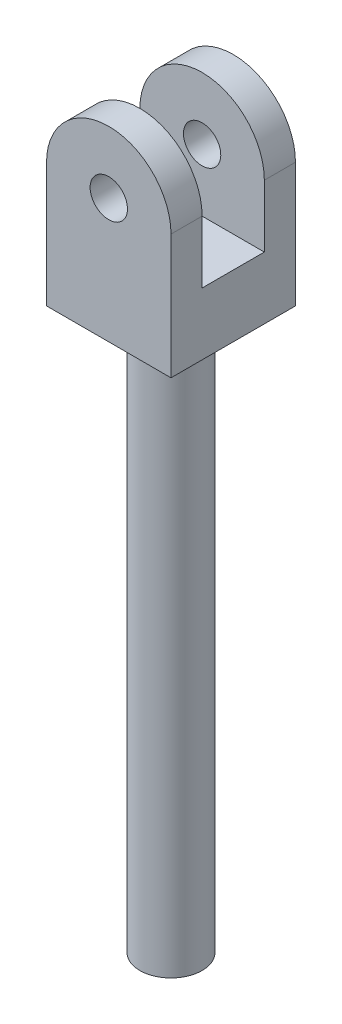
from build123d import *

# Parameters (mm, degrees)
CROQUIS1_R              = 1.5
SALIENTE_EXTRUIR1_DEPTH = 10
CROQUIS2_R              = 2.5
SALIENTE_EXTRUIR2_DEPTH = 45
CROQUIS3_W              = 5
CROQUIS3_H              = 10
CORTAR_EXTRUIR1_DEPTH   = 40


with BuildPart() as part:
    # Croquis1 → Saliente-Extruir1 (new body)
    with BuildSketch(Plane.XY):
        with BuildLine():
            Line((-5, 0), (-5, -10))
            Line((-5, -10), (5, -10))
            Line((5, -10), (5, 0))
            ThreePointArc((5, 0), (0, 5), (-5, 0))
        make_face()
        Circle(CROQUIS1_R, mode=Mode.SUBTRACT)
    extrude(amount=SALIENTE_EXTRUIR1_DEPTH)

    # Croquis2 → Saliente-Extruir2 (add)
    with BuildSketch(Plane.XZ.offset(10)):
        with Locations((0, 5)):
            Circle(CROQUIS2_R)
    extrude(amount=SALIENTE_EXTRUIR2_DEPTH)

    # Croquis3 → Cortar-Extruir1 (cut)
    with BuildSketch(Plane.ZY.offset(5)):
        with Locations((5, 0)):
            Rectangle(CROQUIS3_W, CROQUIS3_H)
    extrude(amount=-CORTAR_EXTRUIR1_DEPTH, mode=Mode.SUBTRACT)


solid = part.part
